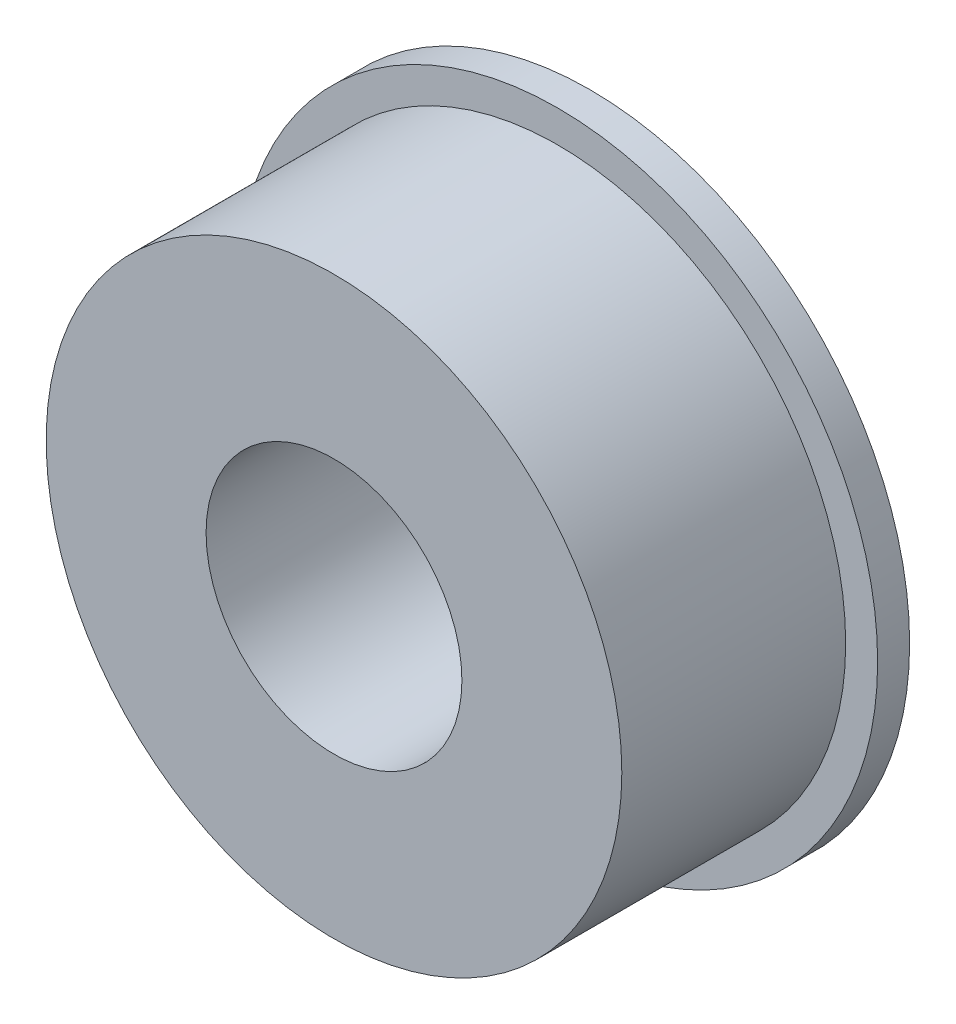
from build123d import *

# Parameters (mm, degrees)
SKETCH2_R           = 15.875
BOSS_EXTRUDE1_DEPTH = 1.5875
SKETCH3_R           = 14.2875
BOSS_EXTRUDE2_DEPTH = 11.1125
SKETCH4_R           = 6.35
CUT_EXTRUDE1_DEPTH  = 26.793821935


with BuildPart() as part:
    # Sketch2 → Boss-Extrude1 (new body)
    with BuildSketch(Plane.XY):
        Circle(SKETCH2_R)
    extrude(amount=BOSS_EXTRUDE1_DEPTH)

    # Sketch3 → Boss-Extrude2 (add)
    with BuildSketch(Plane.XY.offset(1.5875)):
        Circle(SKETCH3_R)
    extrude(amount=BOSS_EXTRUDE2_DEPTH)

    # Sketch4 → Cut-Extrude1 (cut, through all)
    with BuildSketch(Plane.XY.offset(12.7)):
        Circle(SKETCH4_R)
    extrude(amount=-CUT_EXTRUDE1_DEPTH, mode=Mode.SUBTRACT)


solid = part.part
